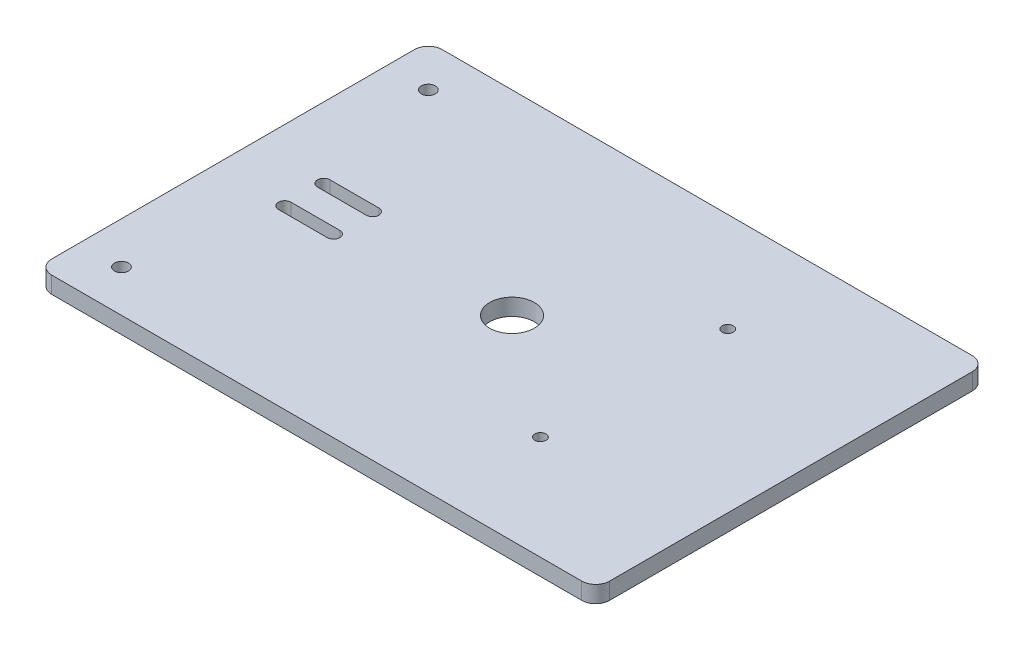
from build123d import *

# Parameters (mm, degrees)
SKETCH2_W           = 200
SKETCH2_H           = 140
BOSS_EXTRUDE1_DEPTH = 6
FILLET1_R           = 5
SKETCH3_R           = 2.5
CUT_EXTRUDE1_DEPTH  = 123.21292894
SKETCH4_R           = 8
CUT_EXTRUDE2_DEPTH  = 123.21292894
CUT_EXTRUDE4_DEPTH  = 123.21292894
SKETCH7_R           = 2
CUT_EXTRUDE5_DEPTH  = 123.21292894


with BuildPart() as part:
    # Sketch2 → Boss-Extrude1 (new body)
    with BuildSketch(Plane(origin=(0, 0, 0), x_dir=(1, 0, 0), z_dir=(0, 1, 0))):
        Rectangle(SKETCH2_W, SKETCH2_H)
    extrude(amount=BOSS_EXTRUDE1_DEPTH)

    # Fillet1
    fillet1_edges = [part.edges().sort_by_distance(p)[0] for p in [
        (100, 3, 70),
        (-100, 3, 70),
        (-100, 3, -70),
        (100, 3, -70),
    ]]
    fillet(fillet1_edges, radius=FILLET1_R)

    # Sketch3 → Cut-Extrude1 (cut, through all)
    with BuildSketch(Plane(origin=(0, 6, 0), x_dir=(1, 0, 0), z_dir=(0, 1, 0))):
        with Locations(Location((-85, 55, 0), (0, 0, 270))):
            Circle(SKETCH3_R)
        with Locations(Location((-85, -55, 0), (0, 0, 90))):
            Circle(SKETCH3_R)
    extrude(amount=-CUT_EXTRUDE1_DEPTH, mode=Mode.SUBTRACT)

    # Sketch4 → Cut-Extrude2 (cut, through all)
    with BuildSketch(Plane(origin=(0, 6, 0), x_dir=(1, 0, 0), z_dir=(0, 1, 0))):
        with Locations(Location((0, 0, 0), (0, 0, 270))):
            Circle(SKETCH4_R)
    extrude(amount=-CUT_EXTRUDE2_DEPTH, mode=Mode.SUBTRACT)

    # Sketch6 → Cut-Extrude4 (cut, through all)
    with BuildSketch(Plane(origin=(0, 6, 0), x_dir=(1, 0, 0), z_dir=(0, 1, 0))):
        with BuildLine():
            Line((-74.688373307, 9.463724756), (-57.188373307, 9.463724756))
            ThreePointArc((-57.188373307, 9.463724756), (-54.938373307, 7.213724756), (-57.188373307, 4.963724756))
            Line((-57.188373307, 4.963724756), (-74.688373307, 4.963724756))
            ThreePointArc((-74.688373307, 4.963724756), (-76.938373307, 7.213724756), (-74.688373307, 9.463724756))
        make_face()
        with BuildLine():
            Line((-74.74772766, -4.486928349), (-57.24772766, -4.486928349))
            ThreePointArc((-57.24772766, -4.486928349), (-54.99772766, -6.736928349), (-57.24772766, -8.986928349))
            Line((-57.24772766, -8.986928349), (-74.74772766, -8.986928349))
            ThreePointArc((-74.74772766, -8.986928349), (-76.99772766, -6.736928349), (-74.74772766, -4.486928349))
        make_face()
    extrude(amount=-CUT_EXTRUDE4_DEPTH, mode=Mode.SUBTRACT)

    # Sketch7 → Cut-Extrude5 (cut, through all)
    with BuildSketch(Plane(origin=(0, 6, 0), x_dir=(1, 0, 0), z_dir=(0, 1, 0))):
        with Locations(Location((42.902668062, -32.720520695, 0), (0, 0, 270))):
            Circle(SKETCH7_R)
        with Locations(Location((42.902668062, 34.418343412, 0), (0, 0, 270))):
            Circle(SKETCH7_R)
    extrude(amount=-CUT_EXTRUDE5_DEPTH, mode=Mode.SUBTRACT)


solid = part.part
